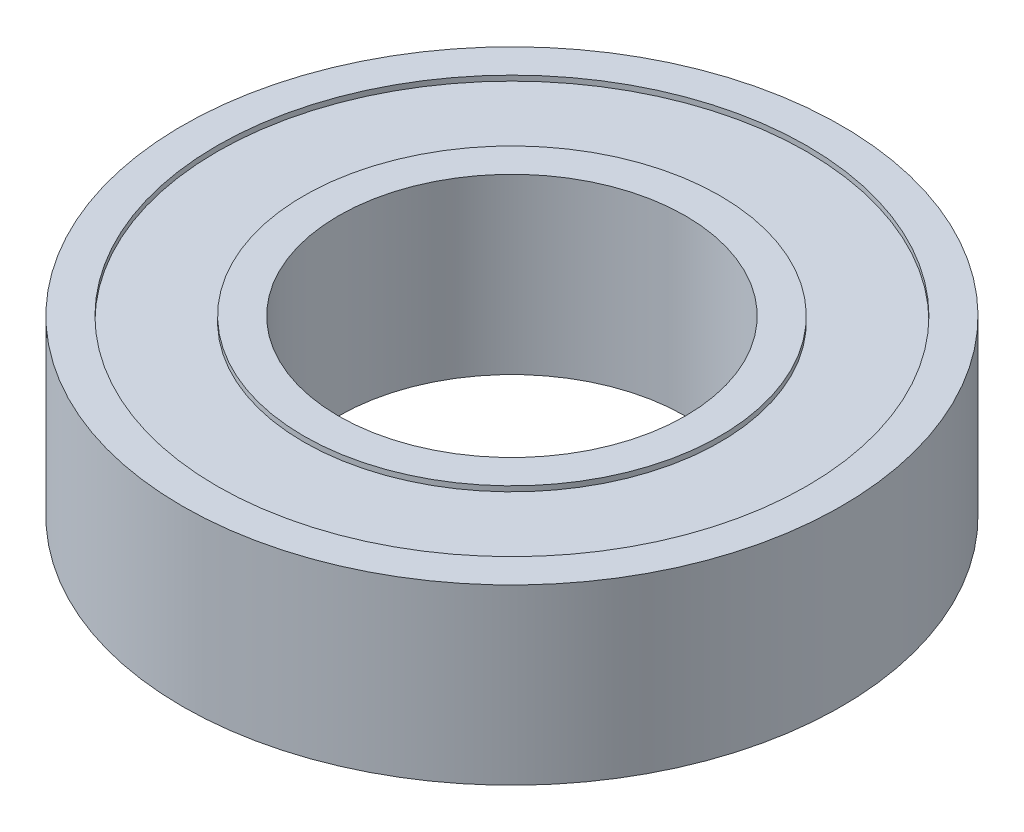
from build123d import *

# Parameters (mm, degrees)
SKETCH1_R           = 9.5
SKETCH1_R_2         = 5
BOSS_EXTRUDE1_DEPTH = 2.5
SKETCH2_R           = 8.5
SKETCH2_R_2         = 6
CUT_EXTRUDE1_DEPTH  = 0.15


with BuildPart() as part:
    # Sketch1 → Boss-Extrude1 (new, symmetric)
    with BuildSketch(Plane(origin=(0, 0, 0), x_dir=(1, 0, 0), z_dir=(0, 1, 0))):
        with Locations(Location((0, 0, 0), (0, 0, 270))):
            Circle(SKETCH1_R)
        with Locations(Location((0, 0, 0), (0, 0, 270))):
            Circle(SKETCH1_R_2, mode=Mode.SUBTRACT)
    extrude(amount=BOSS_EXTRUDE1_DEPTH, both=True)

    # Sketch2 → Cut-Extrude1 (cut)
    with BuildSketch(Plane(origin=(0, 2.5, 0), x_dir=(1, 0, 0), z_dir=(0, 1, 0))):
        with Locations(Location((0, 0, 0), (0, 0, 270))):
            Circle(SKETCH2_R)
        with Locations(Location((0, 0, 0), (0, 0, 270))):
            Circle(SKETCH2_R_2, mode=Mode.SUBTRACT)
    cut_extrude1 = extrude(amount=-CUT_EXTRUDE1_DEPTH, mode=Mode.SUBTRACT)

    # Mirror1: Cut-Extrude1 across plane
    add(cut_extrude1.mirror(Plane.ZX), mode=Mode.SUBTRACT)


solid = part.part
